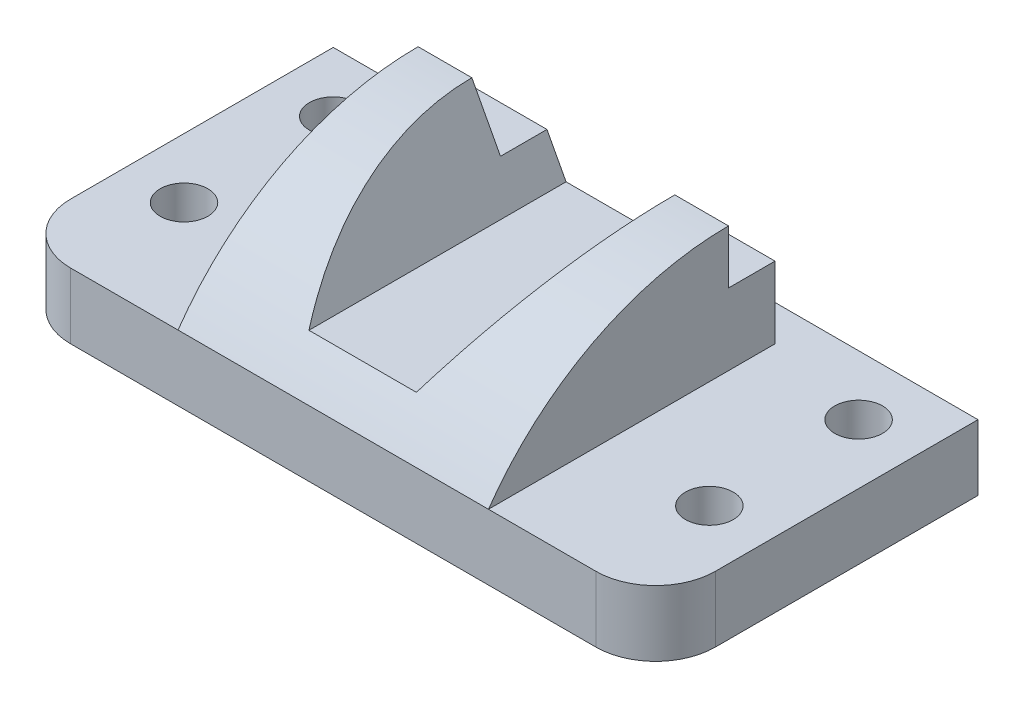
from build123d import *

# Parameters (mm, degrees)
BOSS_EXTRUDE1_DEPTH = 27
CUT_EXTRUDE1_DEPTH  = 116.83177457
SKETCH3_R           = 4
CUT_EXTRUDE2_DEPTH  = 64.921827258
FILLET1_R           = 10


with BuildPart() as part:
    # Sketch1 → Boss-Extrude1 (new, symmetric)
    with BuildSketch(Plane.XY):
        Polygon((-54, 0), (0, 0), (0, 11), (-26, 11), (-54, 11), align=None)
        Polygon((-26, 11), (0, 11), (0, 17), (-9, 17), (-13.235294044, 24.941176333), (-17, 32), (-26, 32), align=None)
        Polygon((0, 11), (0, 0), (54, 0), (54, 11), (26, 11), align=None)
        Polygon((0, 17), (0, 11), (26, 11), (26, 32), (17, 32), (13.235294044, 24.941176333), (9, 17), align=None)
    extrude(amount=BOSS_EXTRUDE1_DEPTH, both=True)

    # Sketch2 → Cut-Extrude1 (cut, through all)
    with BuildSketch(Plane(origin=(54, 0, 0), x_dir=(0, 0, -1), z_dir=(1, 0, 0))):
        with BuildLine():
            Line((-27, 32), (-27, 11))
            ThreePointArc((-27, 11), (-9.470653919, 26.433857761), (13.211938526, 32))
            Line((13.211938526, 32), (-27, 32))
        make_face()
        Polygon((21, 23), (21, 11), (27, 11), (27, 32), (13.211938526, 32), (13.211938526, 23), align=None)
    extrude(amount=-CUT_EXTRUDE1_DEPTH, mode=Mode.SUBTRACT)

    # Sketch3 → Cut-Extrude2 (cut, through all)
    with BuildSketch(Plane(origin=(0, 11, 0), x_dir=(1, 0, 0), z_dir=(0, 1, 0))):
        with Locations(Location((-44, 17, 0), (0, 0, 270))):
            Circle(SKETCH3_R)
        with Locations(Location((-44, -8, 0), (0, 0, 270))):
            Circle(SKETCH3_R)
        with Locations(Location((44, -8, 0), (0, 0, 90))):
            Circle(SKETCH3_R)
        with Locations(Location((44, 17, 0), (0, 0, 90))):
            Circle(SKETCH3_R)
    extrude(amount=-CUT_EXTRUDE2_DEPTH, mode=Mode.SUBTRACT)

    # Fillet1
    fillet1_edges = [part.edges().sort_by_distance(p)[0] for p in [
        (-54, 5.5, 27),
        (54, 5.5, 27),
    ]]
    fillet(fillet1_edges, radius=FILLET1_R)


solid = part.part
